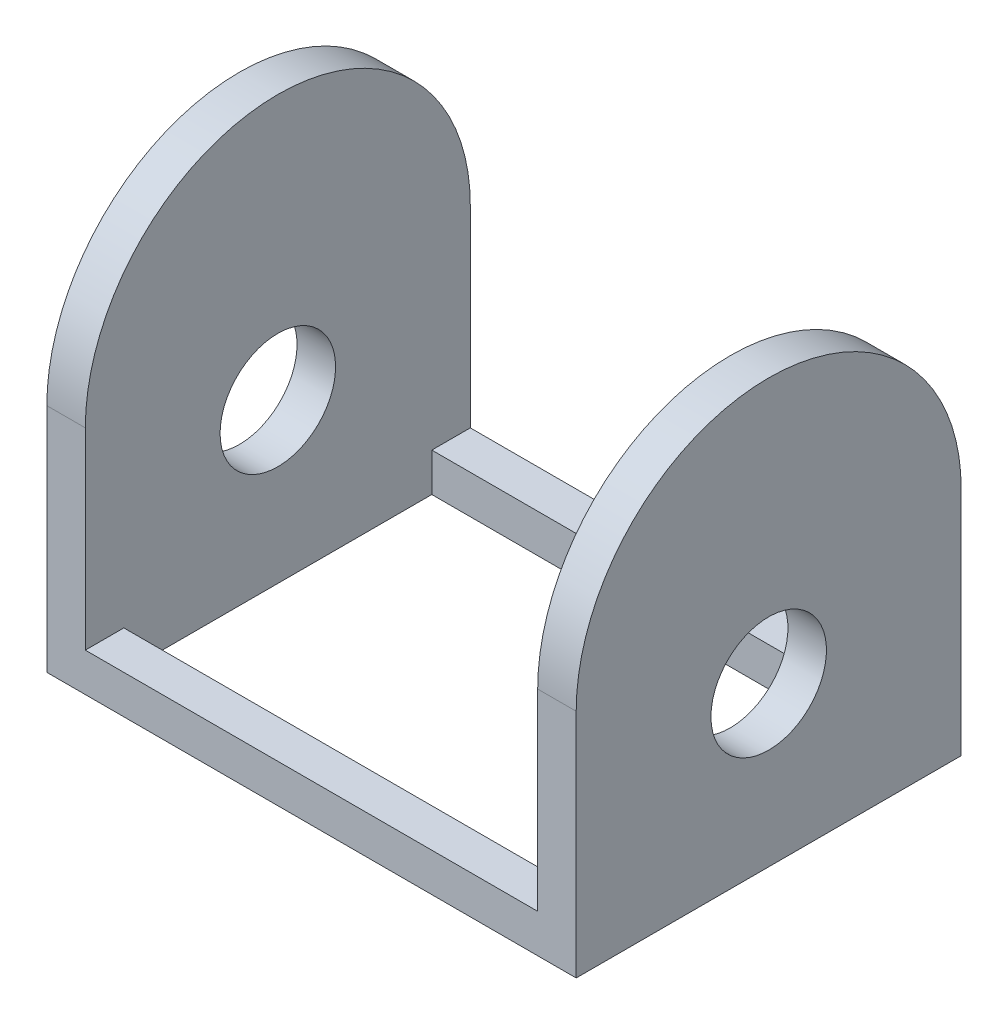
from build123d import *

# Parameters (mm, degrees)
SKETCH1_W           = 27.5
SKETCH1_H           = 40
BOSS_EXTRUDE4_DEPTH = 4
SKETCH5_W           = 4
SKETCH5_H           = 40
BOSS_EXTRUDE5_DEPTH = 20
SKETCH6_R           = 6
CUT_EXTRUDE2_DEPTH  = 42.620307543
BOSS_EXTRUDE6_DEPTH = 4
SKETCH8_W           = 47
SKETCH8_H           = 32
CUT_EXTRUDE3_DEPTH  = 53.5


with BuildPart() as part:
    # Sketch1 → Boss-Extrude4 (new body)
    with BuildSketch(Plane(origin=(0, 0, 0), x_dir=(1, 0, 0), z_dir=(0, 1, 0))):
        with Locations((-13.75, 0)):
            Rectangle(SKETCH1_W, SKETCH1_H)
    boss_extrude4 = extrude(amount=BOSS_EXTRUDE4_DEPTH)

    # Sketch5 → Boss-Extrude5 (add)
    with BuildSketch(Plane(origin=(0, 4, 0), x_dir=(1, 0, 0), z_dir=(0, 1, 0))):
        with Locations((-25.5, 0)):
            Rectangle(SKETCH5_W, SKETCH5_H)
    boss_extrude5 = extrude(amount=BOSS_EXTRUDE5_DEPTH)

    # Sketch6 → Cut-Extrude2 (cut, through all)
    with BuildSketch(Plane.ZY.offset(27.5)):
        with Locations((0, 16.5)):
            Circle(SKETCH6_R)
    cut_extrude2 = extrude(amount=-CUT_EXTRUDE2_DEPTH, mode=Mode.SUBTRACT)

    # Sketch7 → Boss-Extrude6 (add)
    with BuildSketch(Plane.ZY.offset(27.5)):
        with BuildLine():
            Line((-20, 24), (20, 24))
            ThreePointArc((20, 24), (0, 44), (-20, 24))
        make_face()
    boss_extrude6 = extrude(amount=-BOSS_EXTRUDE6_DEPTH)

    # Mirror2: Boss-Extrude4, Boss-Extrude5, Cut-Extrude2, Boss-Extrude6 across plane
    add(boss_extrude4.mirror(Plane(origin=(0, 0, 0), x_dir=(0, 0, 1), z_dir=(1, 0, 0))))
    add(boss_extrude5.mirror(Plane(origin=(0, 0, 0), x_dir=(0, 0, 1), z_dir=(1, 0, 0))))
    add(cut_extrude2.mirror(Plane(origin=(0, 0, 0), x_dir=(0, 0, 1), z_dir=(1, 0, 0))), mode=Mode.SUBTRACT)
    add(boss_extrude6.mirror(Plane(origin=(0, 0, 0), x_dir=(0, 0, 1), z_dir=(1, 0, 0))))

    # Sketch8 → Cut-Extrude3 (cut, through all)
    with BuildSketch(Plane(origin=(0, 4, 0), x_dir=(1, 0, 0), z_dir=(0, 1, 0))):
        Rectangle(SKETCH8_W, SKETCH8_H)
    extrude(amount=-CUT_EXTRUDE3_DEPTH, mode=Mode.SUBTRACT)


solid = part.part
